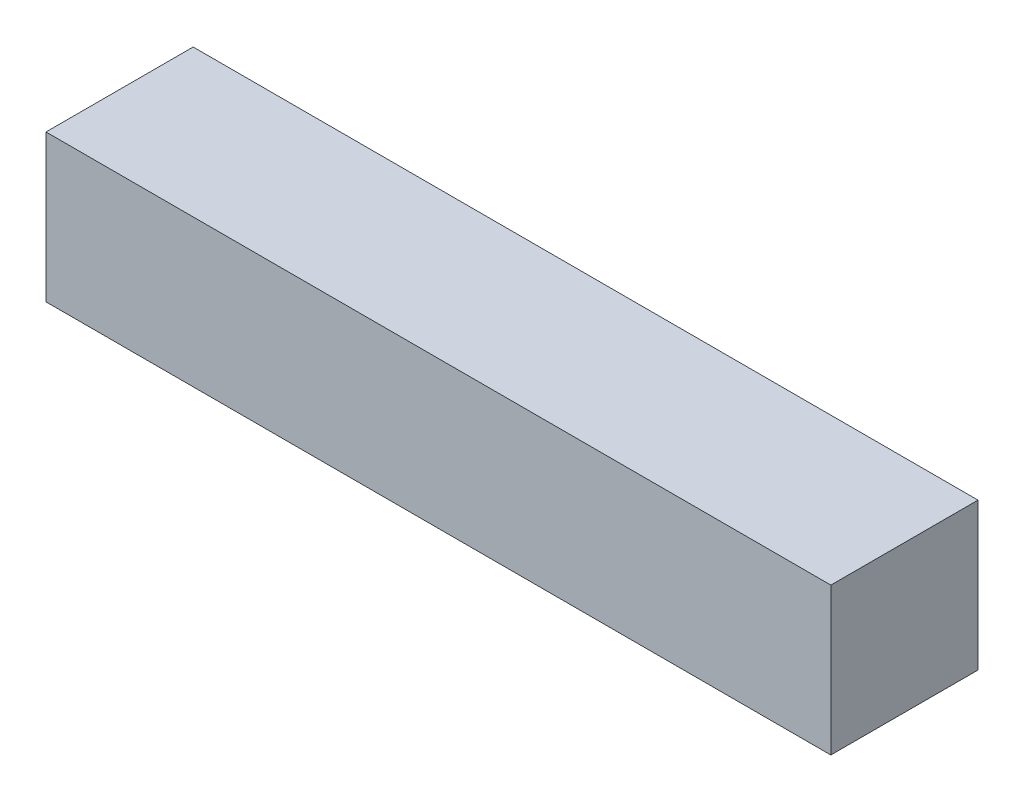
from build123d import *

# Parameters (mm, degrees)
SKETCH1_W           = 203.2
SKETCH1_H           = 38.1
BOSS_EXTRUDE1_DEPTH = 38.1


with BuildPart() as part:
    # Sketch1 → Boss-Extrude1 (new body)
    with BuildSketch(Plane.XY):
        Rectangle(SKETCH1_W, SKETCH1_H)
    extrude(amount=BOSS_EXTRUDE1_DEPTH)


solid = part.part
